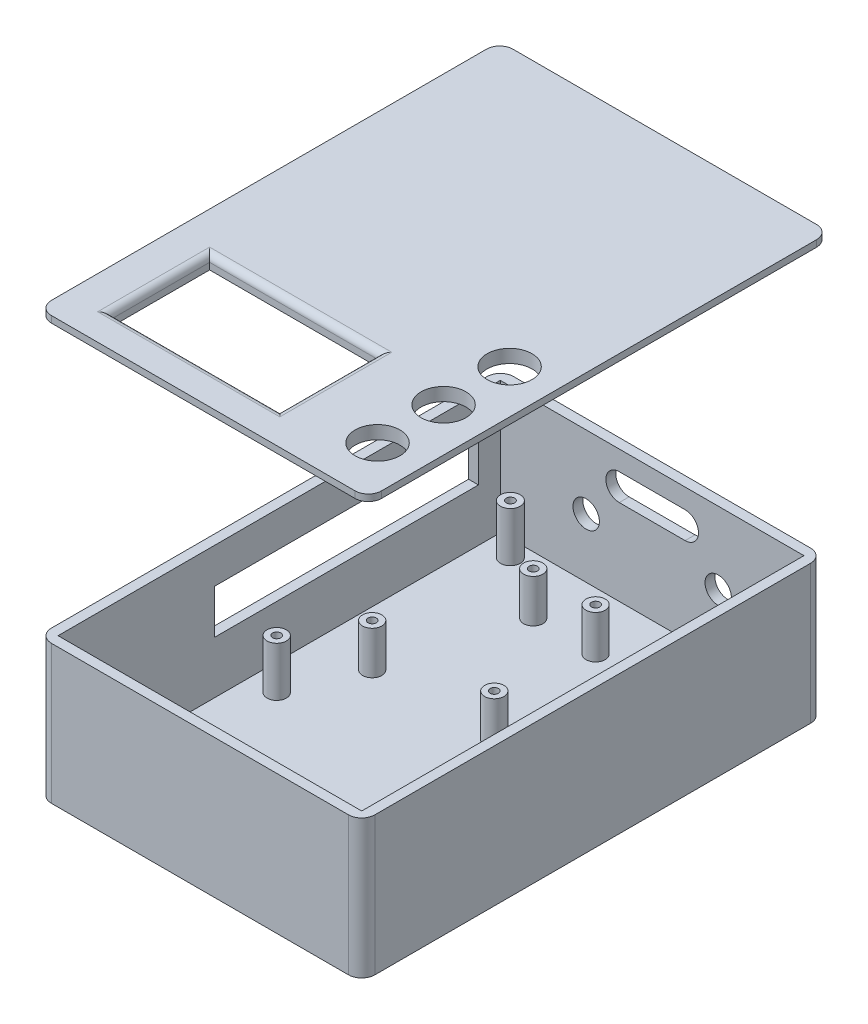
from build123d import *

# Parameters (mm, degrees)
SKETCH1_W            = 124.46
SKETCH1_H            = 177.8
BOSS_EXTRUDE1_DEPTH  = 50.8
SKETCH2_W            = 116.84
SKETCH2_H            = 170.18
CUT_EXTRUDE1_DEPTH   = 50.8
SKETCH4_W            = 124.46
SKETCH4_H            = 177.8
BOSS_EXTRUDE2_DEPTH  = 2.54
SKETCH5_W            = 114.3
SKETCH5_H            = 166.37
BOSS_EXTRUDE3_DEPTH  = 2.54
SKETCH6_W            = 127
SKETCH6_H            = 177.565468033
BOSS_EXTRUDE4_DEPTH  = 2.54
SKETCH7_R            = 8.636
SKETCH7_W            = 65
SKETCH7_H            = 38
CUT_EXTRUDE2_DEPTH   = 7.62
FILLET1_R            = 5.08
FILLET2_R            = 5.08
FILLET3_R            = 5.08
FILLET4_R            = 5.08
FILLET5_R            = 5.08
FILLET6_R            = 5.08
FILLET7_R            = 5.08
FILLET8_R            = 5.08
CUT_EXTRUDE3_DEPTH   = 10.16
SKETCH10_W           = 101.6
SKETCH10_H           = 17
CUT_EXTRUDE5_DEPTH   = 10.16
FILLET9_R            = 2.54
FILLET10_R           = 2.54
FILLET11_R           = 2.54
FILLET12_R           = 2.54
SKETCH12_R           = 3.716498952
SKETCH12_R_2         = 1.6
SKETCH12_R_3         = 3.81
BOSS_EXTRUDE9_DEPTH  = 19.05
SKETCH31_R           = 3.7084
SKETCH31_R_2         = 1.599946
BOSS_EXTRUDE10_DEPTH = 16.51
CUT_EXTRUDE13_START  = -16.51
SKETCH33_R           = 1.599946
SKETCH33_R_2         = 1.59766
CUT_EXTRUDE13_DEPTH  = 16.51
SKETCH35_R           = 5.08
CUT_EXTRUDE14_DEPTH  = 16.51


with BuildPart() as part:
    # Sketch1 → Boss-Extrude1 (new body)
    with BuildSketch(Plane(origin=(0, 0, 0), x_dir=(1, 0, 0), z_dir=(0, 1, 0))):
        with Locations((62.23, 88.9)):
            Rectangle(SKETCH1_W, SKETCH1_H)
    extrude(amount=BOSS_EXTRUDE1_DEPTH)

    # Sketch2 → Cut-Extrude1 (cut)
    with BuildSketch(Plane(origin=(0, 50.8, 0), x_dir=(1, 0, 0), z_dir=(0, 1, 0))):
        with Locations((62.23, 88.9)):
            Rectangle(SKETCH2_W, SKETCH2_H)
    extrude(amount=-CUT_EXTRUDE1_DEPTH, mode=Mode.SUBTRACT)

    # Sketch4 → Boss-Extrude2 (add)
    with BuildSketch(Plane(origin=(0, 0, 0), x_dir=(-1, 0, 0), z_dir=(0, -1, 0))):
        with Locations((-62.23, 88.9)):
            Rectangle(SKETCH4_W, SKETCH4_H)
    extrude(amount=BOSS_EXTRUDE2_DEPTH)

    # Fillet1
    fillet1_edges = [part.edges().sort_by_distance(p)[0] for p in [
        (124.46, 24.13, 0),
    ]]
    fillet(fillet1_edges, radius=FILLET1_R)

    # Fillet3
    fillet3_edges = [part.edges().sort_by_distance(p)[0] for p in [
        (124.46, 24.13, -177.8),
    ]]
    fillet(fillet3_edges, radius=FILLET3_R)

    # Fillet4
    fillet4_edges = [part.edges().sort_by_distance(p)[0] for p in [
        (0, 24.13, -177.8),
    ]]
    fillet(fillet4_edges, radius=FILLET4_R)

    # Fillet5
    fillet5_edges = [part.edges().sort_by_distance(p)[0] for p in [
        (0, 24.13, 0),
    ]]
    fillet(fillet5_edges, radius=FILLET5_R)

    # Sketch9 → Cut-Extrude3 (cut)
    with BuildSketch(Plane(origin=(0, 0, -177.8), x_dir=(-1, 0, 0), z_dir=(0, 0, -1))):
        with BuildLine():
            Line((-49.574364587, 32.954781393), (-74.93, 32.954781393))
            ThreePointArc((-74.93, 32.954781393), (-80.075218607, 38.1), (-74.93, 43.245218607))
            Line((-74.93, 43.245218607), (-49.574364587, 43.245218607))
            ThreePointArc((-49.574364587, 43.245218607), (-44.42914598, 38.1), (-49.574364587, 32.954781393))
        make_face()
    extrude(amount=-CUT_EXTRUDE3_DEPTH, mode=Mode.SUBTRACT)

    # Sketch10 → Cut-Extrude5 (cut)
    with BuildSketch(Plane.ZY):
        with Locations((-114.774057785, 28.646804291)):
            Rectangle(SKETCH10_W, SKETCH10_H)
    extrude(amount=-CUT_EXTRUDE5_DEPTH, mode=Mode.SUBTRACT)

    # Sketch12 → Boss-Extrude9 (add)
    # profile 1 of 4: a face of its own
    with BuildSketch(Plane(origin=(0, 0, 0), x_dir=(1, 0, 0), z_dir=(0, 1, 0))):
        with Locations(Location((14.04, 77.724, 0), (0, 0, 90))):
            Circle(SKETCH12_R)
        with Locations(Location((14.04, 77.724, 0), (0, 0, 90))):
            Circle(SKETCH12_R_2, mode=Mode.SUBTRACT)
    # profile 2 of 4: a face of its own
    with BuildSketch(Plane(origin=(0, 0, 0), x_dir=(1, 0, 0), z_dir=(0, 1, 0))):
        with Locations(Location((109.658, 77.851, 0), (0, 0, 90))):
            Circle(SKETCH12_R_3)
        with Locations(Location((109.658, 77.851, 0), (0, 0, 90))):
            Circle(SKETCH12_R_2, mode=Mode.SUBTRACT)
    # profile 3 of 4: a face of its own
    with BuildSketch(Plane(origin=(0, 0, 0), x_dir=(1, 0, 0), z_dir=(0, 1, 0))):
        with Locations(Location((109.658, 167.64, 0), (0, 0, 90))):
            Circle(SKETCH12_R_3)
        with Locations(Location((109.658, 167.64, 0), (0, 0, 90))):
            Circle(SKETCH12_R_2, mode=Mode.SUBTRACT)
    # profile 4 of 4: a face of its own
    with BuildSketch(Plane(origin=(0, 0, 0), x_dir=(1, 0, 0), z_dir=(0, 1, 0))):
        with Locations(Location((14.04, 167.64, 0), (0, 0, 90))):
            Circle(SKETCH12_R_3)
        with Locations(Location((14.04, 167.64, 0), (0, 0, 90))):
            Circle(SKETCH12_R_2, mode=Mode.SUBTRACT)
    extrude(amount=BOSS_EXTRUDE9_DEPTH)

    # Sketch31 → Boss-Extrude10 (add)
    # profile 1 of 4: a face of its own
    with BuildSketch(Plane(origin=(0, 0, 0), x_dir=(1, 0, 0), z_dir=(0, 1, 0))):
        with Locations(Location((24.872030931, 103.626030931, 0), (0, 0, 90))):
            Circle(SKETCH31_R)
        with Locations(Location((24.872030931, 103.626030931, 0), (0, 0, 270))):
            Circle(SKETCH31_R_2, mode=Mode.SUBTRACT)
    # profile 2 of 4: a face of its own
    with BuildSketch(Plane(origin=(0, 0, 0), x_dir=(1, 0, 0), z_dir=(0, 1, 0))):
        with Locations(Location((71.862030931, 103.626030931, 0), (0, 0, 90))):
            Circle(SKETCH31_R)
        with Locations(Location((71.862030931, 103.626030931, 0), (0, 0, 270))):
            Circle(SKETCH31_R_2, mode=Mode.SUBTRACT)
    # profile 3 of 4: a face of its own
    with BuildSketch(Plane(origin=(0, 0, 0), x_dir=(1, 0, 0), z_dir=(0, 1, 0))):
        with Locations(Location((38.588030931, 151.886030931, 0), (0, 0, 90))):
            Circle(SKETCH31_R)
        with Locations(Location((38.588030931, 151.886030931, 0), (0, 0, 270))):
            Circle(SKETCH31_R_2, mode=Mode.SUBTRACT)
    # profile 4 of 4: a face of its own
    with BuildSketch(Plane(origin=(0, 0, 0), x_dir=(1, 0, 0), z_dir=(0, 1, 0))):
        with Locations(Location((62.588030931, 151.886030931, 0), (0, 0, 90))):
            Circle(SKETCH31_R)
        with Locations(Location((62.588030931, 151.886030931, 0), (0, 0, 270))):
            Circle(SKETCH31_R_2, mode=Mode.SUBTRACT)
    extrude(amount=BOSS_EXTRUDE10_DEPTH)

    # Sketch33 → Cut-Extrude13 (cut)
    with BuildSketch(Plane(origin=(0, 0, 0), x_dir=(1, 0, 0), z_dir=(0, 1, 0)).offset(CUT_EXTRUDE13_START)):
        with Locations(Location((109.728, 77.724, 0), (0, 0, 206.286642075))):
            Circle(SKETCH33_R)
        with Locations(Location((13.97, 77.724, 0), (0, 0, 271.20927691))):
            Circle(SKETCH33_R)
        with Locations(Location((71.862030931, 103.626030931, 0), (0, 0, 270))):
            Circle(SKETCH33_R_2)
        with Locations(Location((24.872030931, 103.626030931, 0), (0, 0, 90))):
            Circle(SKETCH33_R)
        with Locations(Location((62.588030931, 151.886030931, 0), (0, 0, 90))):
            Circle(SKETCH33_R)
        with Locations(Location((38.588030931, 151.886030931, 0), (0, 0, 90))):
            Circle(SKETCH33_R)
        with Locations(Location((109.728, 167.64, 0), (0, 0, 268.79072309))):
            Circle(SKETCH33_R)
        with Locations(Location((13.97, 167.64, 0), (0, 0, 271.20927691))):
            Circle(SKETCH33_R)
    extrude(amount=CUT_EXTRUDE13_DEPTH, mode=Mode.SUBTRACT)

    # Sketch35 → Cut-Extrude14 (cut)
    with BuildSketch(Plane(origin=(0, 0, -177.8), x_dir=(-1, 0, 0), z_dir=(0, 0, -1))):
        with Locations((-87.652182294, 22.794781393)):
            Circle(SKETCH35_R)
        with Locations((-36.852182294, 22.794781393)):
            Circle(SKETCH35_R)
    extrude(amount=-CUT_EXTRUDE14_DEPTH, mode=Mode.SUBTRACT)


with BuildPart() as body_2:
    # Sketch5 → Boss-Extrude3 (new body)
    with BuildSketch(Plane(origin=(0, 154.94, 0), x_dir=(1, 0, 0), z_dir=(0, 1, 0))):
        with Locations((63.5, 89.535)):
            Rectangle(SKETCH5_W, SKETCH5_H)
    extrude(amount=BOSS_EXTRUDE3_DEPTH)

    # Sketch6 → Boss-Extrude4 (add)
    with BuildSketch(Plane(origin=(0, 157.48, 0), x_dir=(1, 0, 0), z_dir=(0, 1, 0))):
        with Locations((63.5, 88.782734017)):
            Rectangle(SKETCH6_W, SKETCH6_H)
    extrude(amount=BOSS_EXTRUDE4_DEPTH)

    # Sketch7 → Cut-Extrude2 (cut)
    with BuildSketch(Plane(origin=(0, 160.02, 0), x_dir=(1, 0, 0), z_dir=(0, 1, 0))):
        with Locations(Location((110.241265821, 20.32, 0), (0, 0, 270))):
            Circle(SKETCH7_R)
        with Locations(Location((110.241265821, 45.72, 0), (0, 0, 270))):
            Circle(SKETCH7_R)
        with Locations(Location((110.241265821, 71.12, 0), (0, 0, 270))):
            Circle(SKETCH7_R)
        with Locations((47.74, 31.7)):
            Rectangle(SKETCH7_W, SKETCH7_H)
    extrude(amount=-CUT_EXTRUDE2_DEPTH, mode=Mode.SUBTRACT)

    # Fillet2
    fillet2_edges = [body_2.edges().sort_by_distance(p)[0] for p in [
        (127, 158.75, 0),
    ]]
    fillet(fillet2_edges, radius=FILLET2_R)

    # Fillet6
    fillet6_edges = [body_2.edges().sort_by_distance(p)[0] for p in [
        (127, 158.75, -177.565468033),
    ]]
    fillet(fillet6_edges, radius=FILLET6_R)

    # Fillet7
    fillet7_edges = [body_2.edges().sort_by_distance(p)[0] for p in [
        (0, 158.75, -177.565468033),
    ]]
    fillet(fillet7_edges, radius=FILLET7_R)

    # Fillet8
    fillet8_edges = [body_2.edges().sort_by_distance(p)[0] for p in [
        (0, 158.75, 0),
    ]]
    fillet(fillet8_edges, radius=FILLET8_R)

    # Fillet9
    fillet9_edges = [body_2.edges().sort_by_distance(p)[0] for p in [
        (47.74, 160.02, -12.7),
    ]]
    fillet(fillet9_edges, radius=FILLET9_R)

    # Fillet10
    fillet10_edges = [body_2.edges().sort_by_distance(p)[0] for p in [
        (80.24, 160.02, -30.43),
    ]]
    fillet(fillet10_edges, radius=FILLET10_R)

    # Fillet11
    fillet11_edges = [body_2.edges().sort_by_distance(p)[0] for p in [
        (49.01, 160.02, -50.7),
    ]]
    fillet(fillet11_edges, radius=FILLET11_R)

    # Fillet12
    fillet12_edges = [body_2.edges().sort_by_distance(p)[0] for p in [
        (15.24, 160.02, -31.7),
    ]]
    fillet(fillet12_edges, radius=FILLET12_R)


solid = Compound([part.part, body_2.part])
